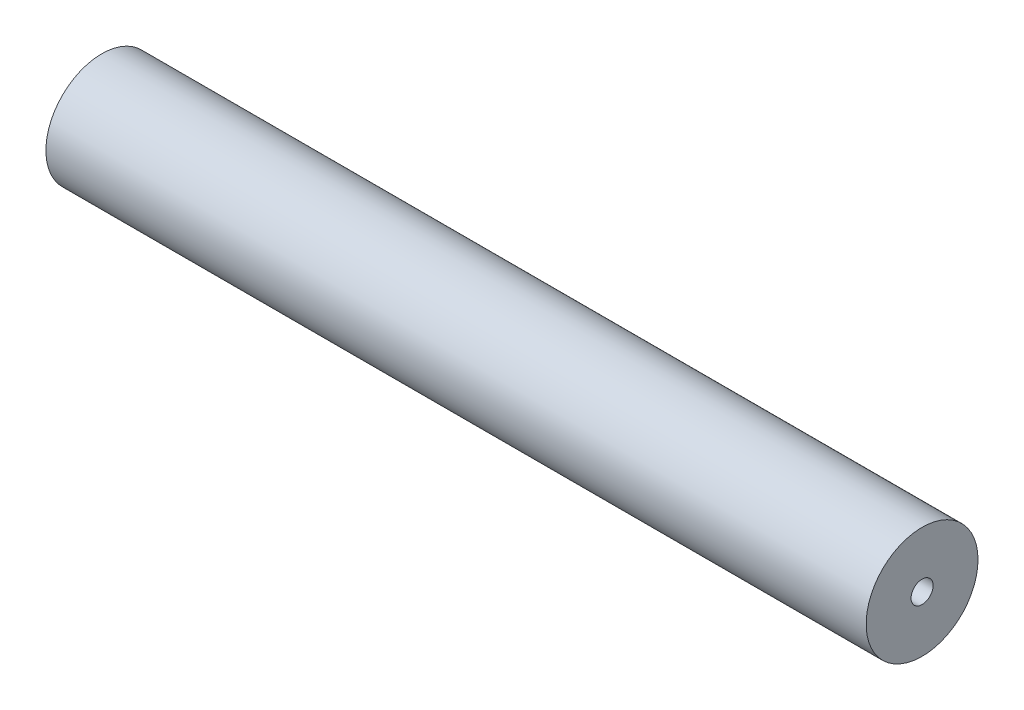
from build123d import *

# Parameters (mm, degrees)
SKETCH1_R                       = 38.1
BOSS_EXTRUDE1_DEPTH             = 558.8
M12_CLEARANCE_HOLE1_D           = 13.5
M12_CLEARANCE_HOLE1_DEPTH       = 21.344190822
M12_CLEARANCE_HOLE1_CSINK_D     = 13.55
M12_CLEARANCE_HOLE1_CSINK_ANGLE = 90
M12_CLEARANCE_HOLE1_TIP         = 4.055809178
M12_CLEARANCE_HOLE2_D           = 15
M12_CLEARANCE_HOLE2_DEPTH       = 20.893545357
M12_CLEARANCE_HOLE2_TIP         = 4.506454643


with BuildPart() as part:
    # Sketch1 → Boss-Extrude1 (new body)
    with BuildSketch(Plane(origin=(0, 0, 0), x_dir=(0, 0, -1), z_dir=(1, 0, 0))):
        Circle(SKETCH1_R)
    extrude(amount=BOSS_EXTRUDE1_DEPTH)

    # M12 Clearance Hole1
    with Locations(Plane.ZY):
        with Locations((0, 0)):
            CounterSinkHole(M12_CLEARANCE_HOLE1_D / 2, M12_CLEARANCE_HOLE1_CSINK_D / 2, depth=M12_CLEARANCE_HOLE1_DEPTH, counter_sink_angle=M12_CLEARANCE_HOLE1_CSINK_ANGLE)
            with Locations((0, 0, -(M12_CLEARANCE_HOLE1_DEPTH + M12_CLEARANCE_HOLE1_TIP / 2))):  # 118° drill point
                Cone(0, M12_CLEARANCE_HOLE1_D / 2, M12_CLEARANCE_HOLE1_TIP, mode=Mode.SUBTRACT)

    # M12 Clearance Hole2
    with Locations(Plane(origin=(558.8, 0, 0), x_dir=(0, 0, -1), z_dir=(1, 0, 0))):
        with Locations((0, 0)):
            Hole(M12_CLEARANCE_HOLE2_D / 2, depth=M12_CLEARANCE_HOLE2_DEPTH)
            with Locations((0, 0, -(M12_CLEARANCE_HOLE2_DEPTH + M12_CLEARANCE_HOLE2_TIP / 2))):  # 118° drill point
                Cone(0, M12_CLEARANCE_HOLE2_D / 2, M12_CLEARANCE_HOLE2_TIP, mode=Mode.SUBTRACT)


solid = part.part
